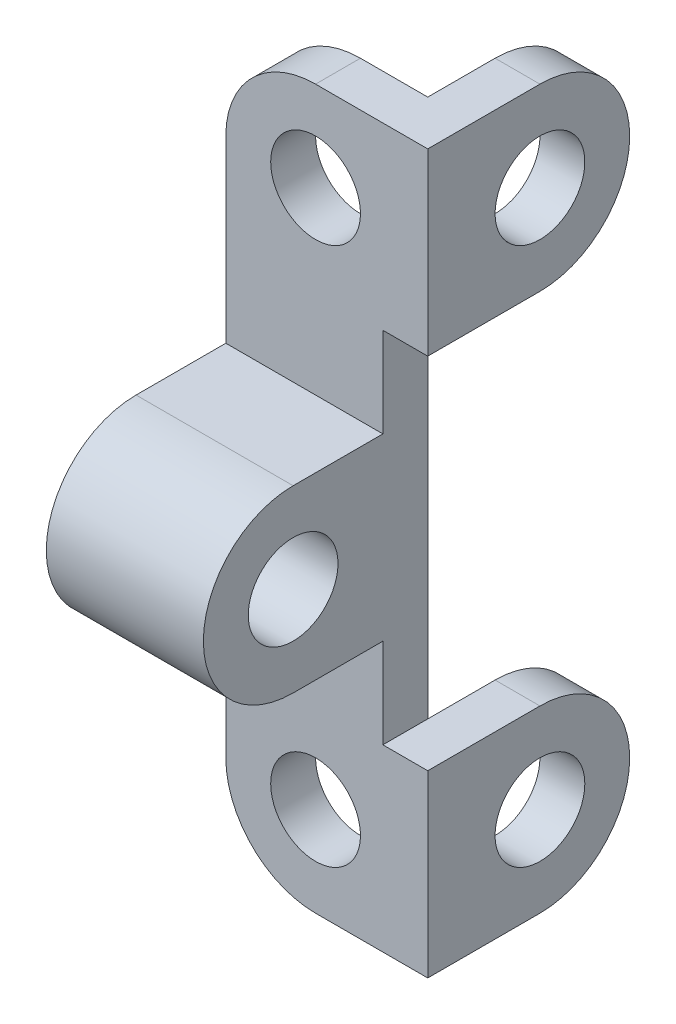
from build123d import *

# Parameters (mm, degrees)
BOSS_EXTRUDE1_DEPTH     = 20
BOSS_EXTRUDE2_DEPTH     = 15
SKETCH1_4_R             = 10
BOSS_EXTRUDE3_DEPTH     = 15
BOSS_EXTRUDE4_START     = -20
SKETCH1_5_R             = 10
BOSS_EXTRUDE4_DEPTH     = 20
FILLET1_R               = 20
SKETCH2_W               = 40
SKETCH2_H               = 10
BOSS_EXTRUDE5_DEPTH     = 10
SKETCH3_R               = 10
BOSS_EXTRUDE6_DEPTH     = 10
CUT_EXTRUDE1_DEPTH      = 107.066017178
CUT_EXTRUDE1_DEPTH_BACK = 107.066017178
SKETCH4_R               = 10


with BuildPart() as part:
    # Sketch1 → Boss-Extrude1 (new body)
    with BuildSketch(Plane.YZ):
        Polygon((20, -20), (-20, -20), (-80, -20), (-80, -30), (80, -30), (80, -20), align=None)
    extrude(amount=-BOSS_EXTRUDE1_DEPTH)

    # Sketch1<3> → Boss-Extrude2 (add)
    with BuildSketch(Plane.YZ):
        Polygon((20, -20), (-20, -20), (-80, -20), (-80, -30), (80, -30), (80, -20), align=None)
    extrude(amount=BOSS_EXTRUDE2_DEPTH)

    # Sketch1<4> → Boss-Extrude3 (add)
    with BuildSketch(Plane.YZ):
        with BuildLine():
            ThreePointArc((20, 0), (0, 20), (-20, 0))
            Line((-20, 0), (-20, -20))
            Line((-20, -20), (20, -20))
            Line((20, -20), (20, 0))
        make_face()
        Circle(SKETCH1_4_R, mode=Mode.SUBTRACT)
    extrude(amount=BOSS_EXTRUDE3_DEPTH)

    # Sketch1<5> → Boss-Extrude4 (add)
    with BuildSketch(Plane.YZ.offset(BOSS_EXTRUDE4_START)):
        with BuildLine():
            ThreePointArc((20, 0), (0, 20), (-20, 0))
            Line((-20, 0), (-20, -20))
            Line((-20, -20), (20, -20))
            Line((20, -20), (20, 0))
        make_face()
        Circle(SKETCH1_5_R, mode=Mode.SUBTRACT)
    extrude(amount=BOSS_EXTRUDE4_DEPTH)

    # Fillet1
    fillet1_edges = [part.edges().sort_by_distance(p)[0] for p in [
        (-20, 80, -25),
        (-20, -80, -25),
    ]]
    fillet(fillet1_edges, radius=FILLET1_R)

    # Sketch2 → Boss-Extrude5 (add)
    with BuildSketch(Plane.YZ.offset(15)):
        with Locations((-60, -25)):
            Rectangle(SKETCH2_W, SKETCH2_H)
        with Locations((60, -25)):
            Rectangle(SKETCH2_W, SKETCH2_H)
    extrude(amount=BOSS_EXTRUDE5_DEPTH)

    # Sketch3 → Boss-Extrude6 (add)
    # profile 1 of 2: a face of its own
    with BuildSketch(Plane.YZ.offset(25)):
        with BuildLine():
            Line((-80, -20), (-40, -20))
            Line((-40, -20), (-40, -45))
            ThreePointArc((-40, -45), (-60, -65), (-80, -45))
            Line((-80, -45), (-80, -20))
        make_face()
        with Locations((-60, -45)):
            Circle(SKETCH3_R, mode=Mode.SUBTRACT)
    # profile 2 of 2: a face of its own
    with BuildSketch(Plane.YZ.offset(25)):
        with BuildLine():
            Line((80, -45), (80, -20))
            Line((80, -20), (40, -20))
            Line((40, -20), (40, -45))
            ThreePointArc((40, -45), (60, -65), (80, -45))
        make_face()
        with Locations((60, -45)):
            Circle(SKETCH3_R, mode=Mode.SUBTRACT)
    extrude(amount=-BOSS_EXTRUDE6_DEPTH)

    # Sketch4 → Cut-Extrude1 (cut, two sides: drawn at the far end of the back side and taken through both)
    with BuildSketch(Plane(origin=(0, 0, 0), x_dir=(0, 1, 0), z_dir=(0, 0, 1)).offset(-CUT_EXTRUDE1_DEPTH_BACK)):
        with Locations((-60, 0)):
            Circle(SKETCH4_R)
        with Locations((60, 0)):
            Circle(SKETCH4_R)
    extrude(amount=CUT_EXTRUDE1_DEPTH + CUT_EXTRUDE1_DEPTH_BACK, mode=Mode.SUBTRACT)


solid = part.part
